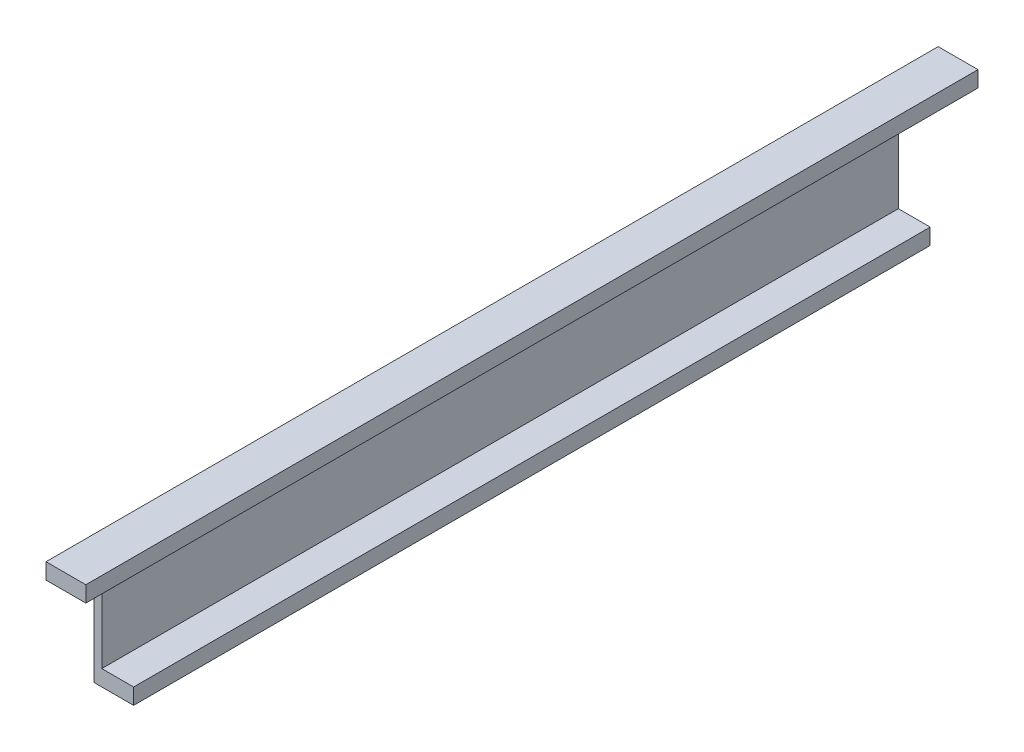
from build123d import *

# Parameters (mm, degrees)
CROQUIS1_R                   = 2.5
SALIENTE_EXTRUIR1_DEPTH      = 1.25
SALIENTE_EXTRUIR4_DEPTH      = 2.5
CROQUIS6_R                   = 12.525
CORTAR_EXTRUIR3_DEPTH        = 10
SALIENTE_EXTRUIR5_DEPTH      = 200
CROQUIS8_R                   = 12.525
SALIENTE_EXTRUIR6_DEPTH      = 21
CROQUIS10_W                  = 18.5
CROQUIS10_H                  = 25.138120499
CROQUIS10_W_2                = 2.5
CROQUIS10_H_2                = 4.861879501
CROQUIS10_H_3                = 5
CORTAR_EXTRUIR5_DEPTH        = 98
SALIENTE_EXTRUIR7_DEPTH      = 50
SALIENTE_EXTRUIR8_DEPTH      = 15
SALIENTE_EXTRUIR8_DEPTH_BACK = 265
CROQUIS15_W                  = 250
CROQUIS15_H                  = 5
CROQUIS15_W_2                = 280
SALIENTE_EXTRUIR9_DEPTH      = 7.5


with BuildPart() as part:
    # Croquis1 → Saliente-Extruir1 (new, symmetric)
    with BuildSketch(Plane(origin=(0, 0, 0), x_dir=(0, 0, -1), z_dir=(1, 0, 0))):
        with BuildLine():
            Line((125, -2.5), (-125, -2.5))
            Line((-125, -2.5), (-125, 2.5))
            Line((-125, 2.5), (-123, 2.5))
            Line((-123, 2.5), (-117, 17.5))
            ThreePointArc((-117, 17.5), (-110, 24.5), (-103, 17.5))
            Line((-103, 17.5), (-97, 2.5))
            Line((-97, 2.5), (125, 2.5))
            Line((125, 2.5), (125, -2.5))
        make_face()
        with Locations((-110, 17.5)):
            Circle(CROQUIS1_R, mode=Mode.SUBTRACT)
    extrude(amount=SALIENTE_EXTRUIR1_DEPTH, both=True)

    # Croquis5 → Saliente-Extruir4 (add, through all)
    with BuildSketch(Plane(origin=(1.25, 0, 0), x_dir=(0, 0, -1), z_dir=(1, 0, 0))):
        with BuildLine():
            ThreePointArc((-100, 10), (-110, 5), (-120, 10))
            Line((-120, 10), (-121.0552482, 7.361879501))
            ThreePointArc((-121.0552482, 7.361879501), (-110, 2.5), (-98.9447518, 7.361879501))
            Line((-98.9447518, 7.361879501), (-100, 10))
        make_face()
        with BuildLine():
            Line((-121.0552482, 7.361879501), (-120, 10))
            ThreePointArc((-120, 10), (-113.952847075, 29.358541226), (-97.5, 17.5))
            ThreePointArc((-97.5, 17.5), (-98.141458774, 13.547152925), (-100, 10))
            Line((-100, 10), (-98.9447518, 7.361879501))
            ThreePointArc((-98.9447518, 7.361879501), (-96.020931308, 12.060731804), (-95, 17.5))
            ThreePointArc((-95, 17.5), (-115.439268196, 31.479068692), (-121.0552482, 7.361879501))
        make_face()
    extrude(amount=-SALIENTE_EXTRUIR4_DEPTH)

    # Croquis6 → Cortar-Extruir3 (cut)
    with BuildSketch(Plane(origin=(1.25, 0, 0), x_dir=(0, 0, -1), z_dir=(1, 0, 0))):
        with Locations((-110, 17.5)):
            Circle(CROQUIS6_R)
    extrude(amount=-CORTAR_EXTRUIR3_DEPTH, mode=Mode.SUBTRACT)

    # Croquis7 → Saliente-Extruir5 (add)
    with BuildSketch(Plane(origin=(0, 0, -125), x_dir=(-1, 0, 0), z_dir=(0, 0, -1))):
        Polygon((3.75, 37.8), (3.75, -2.5), (1.25, -2.5), (1.25, 2.5), (1.25, 32.8), (-1.25, 32.8), (-1.25, 37.8), align=None)
    extrude(amount=-SALIENTE_EXTRUIR5_DEPTH)

    # Croquis8 → Saliente-Extruir6 (add)
    with BuildSketch(Plane.ZY.offset(1.25)):
        with BuildLine():
            Line((98.9447518, 7.361879501), (97, 2.5))
            Line((97, 2.5), (95, 2.5))
            Line((95, 2.5), (95, -2.5))
            Line((95, -2.5), (125, -2.5))
            Line((125, -2.5), (125, 2.5))
            Line((125, 2.5), (123, 2.5))
            Line((123, 2.5), (121.0552482, 7.361879501))
            ThreePointArc((121.0552482, 7.361879501), (110, 32.5), (98.9447518, 7.361879501))
        make_face()
        with Locations(Location((110, 17.5, 0), (0, 0, 180))):
            Circle(CROQUIS8_R, mode=Mode.SUBTRACT)
    extrude(amount=SALIENTE_EXTRUIR6_DEPTH)

    # Croquis10 → Cortar-Extruir5 (cut)
    with BuildSketch(Plane.XY.offset(75)):
        with Locations((-13, 19.930939751)):
            Rectangle(CROQUIS10_W, CROQUIS10_H)
        Polygon((1.25, 37.8), (-3.75, 37.8), (-3.75, 32.5), (-1.25, 32.5), (-1.25, 32.8), (1.25, 32.8), align=None)
        with Locations((0, 19.930939751)):
            Rectangle(CROQUIS10_W_2, CROQUIS10_H)
        with Locations((-2.5, 19.930939751)):
            Rectangle(CROQUIS10_W_2, CROQUIS10_H)
        with Locations((-13, 4.930939751)):
            Rectangle(CROQUIS10_W, CROQUIS10_H_2)
        with Locations((-2.5, 4.930939751)):
            Rectangle(CROQUIS10_W_2, CROQUIS10_H_2)
        with Locations((0, 4.930939751)):
            Rectangle(CROQUIS10_W_2, CROQUIS10_H_2)
        with Locations((-2.5, 0)):
            Rectangle(CROQUIS10_W_2, CROQUIS10_H_3)
        with Locations((-13, 0)):
            Rectangle(CROQUIS10_W, CROQUIS10_H_3)
        Rectangle(CROQUIS10_W_2, CROQUIS10_H_3)
    extrude(amount=CORTAR_EXTRUIR5_DEPTH, mode=Mode.SUBTRACT)

    # Croquis11 → Saliente-Extruir7 (add)
    with BuildSketch(Plane.XY.offset(75)):
        Polygon((-3.75, 37.8), (-3.75, -2.5), (1.25, -2.5), (1.25, 2.5), (-1.25, 2.5), (-1.25, 32.8), (1.25, 32.8), (1.25, 37.8), align=None)
    extrude(amount=SALIENTE_EXTRUIR7_DEPTH)

    # Croquis14 → Saliente-Extruir8 (add, two sides: drawn at the far end of the back side and taken through both)
    with BuildSketch(Plane.XY.offset(125).offset(-SALIENTE_EXTRUIR8_DEPTH_BACK)):
        Polygon((-1.25, 32.8), (1.25, 32.8), (1.25, 37.8), (-3.75, 37.8), (-3.75, 32.8), align=None)
    extrude(amount=SALIENTE_EXTRUIR8_DEPTH + SALIENTE_EXTRUIR8_DEPTH_BACK)

    # Croquis15 → Saliente-Extruir9 (add)
    with BuildSketch(Plane(origin=(1.25, 0, 0), x_dir=(0, 0, -1), z_dir=(1, 0, 0))):
        Rectangle(CROQUIS15_W, CROQUIS15_H)
        with Locations((0, 35.3)):
            Rectangle(CROQUIS15_W_2, CROQUIS15_H)
    extrude(amount=SALIENTE_EXTRUIR9_DEPTH)


solid = part.part
